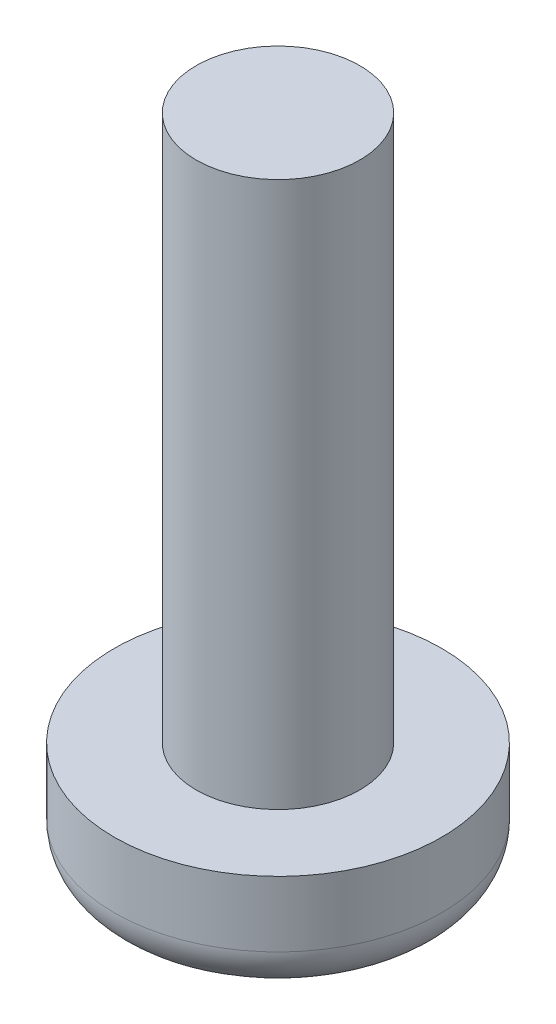
from build123d import *

# Parameters (mm, degrees)
ESBO_O1_R                = 1.5
RESSALTO_EXTRUS_O1_DEPTH = 10
ESBO_O1_3_R              = 3
RESSALTO_EXTRUS_O2_DEPTH = 2
FILETE1_R                = 0.8


with BuildPart() as part:
    # Esboço1 → Ressalto-extrusão1 (new body)
    with BuildSketch(Plane(origin=(0, 0, 0), x_dir=(1, 0, 0), z_dir=(0, 1, 0))):
        Circle(ESBO_O1_R)
    extrude(amount=RESSALTO_EXTRUS_O1_DEPTH)


with BuildPart() as body_2:
    # Esboço1<3> → Ressalto-extrusão2 (new body)
    with BuildSketch(Plane(origin=(0, 0, 0), x_dir=(1, 0, 0), z_dir=(0, 1, 0))):
        Circle(ESBO_O1_3_R)
    extrude(amount=-RESSALTO_EXTRUS_O2_DEPTH)

    # Filete1
    filete1_edges = [body_2.edges().sort_by_distance(p)[0] for p in [
        (-3, -2, 0),
    ]]
    fillet(filete1_edges, radius=FILETE1_R)


solid = Compound([part.part, body_2.part])
